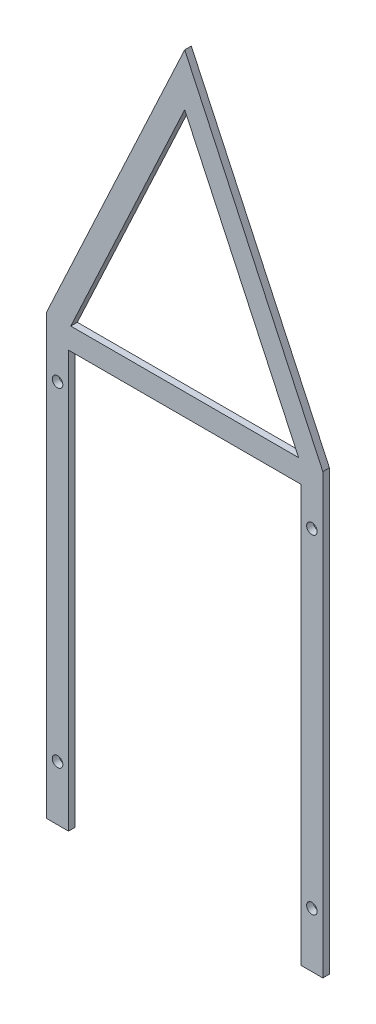
from build123d import *

# Parameters (mm, degrees)
RECTANGLE_RIB_DEPTH                  = 1.5
TRIANGLE_RIB_DEPTH                   = 3
M4_CLEARANCE_HOLE1_D                 = 4.8
MIRROR1_AT_THE_SECOND_PLANE_COPY_1_D = 4.8


with BuildPart() as part:
    # Sketch1 → Rectangle Rib (new, symmetric)
    with BuildSketch(Plane.XY):
        Polygon((-63, -100), (-53, -100), (-53, -90), (-53, 90), (53, 90), (53, -90), (53, -100), (63, -100), (63, 100), (-63, 100), align=None)
    extrude(amount=RECTANGLE_RIB_DEPTH, both=True)

    # Sketch2 → Triangle Rib (add)
    with BuildSketch(Plane.XY.offset(1.5)):
        Polygon((-63, 100), (0, 235.103935992), (63, 100), (51.96622081, 100), (0, 211.441920161), (-51.96622081, 100), align=None)
    extrude(amount=-TRIANGLE_RIB_DEPTH)

    # M4 Clearance Hole1 (through all)
    with Locations(Plane.XY.offset(1.5)):
        with Locations((-58, 75)):
            m4_clearance_hole1 = Hole(M4_CLEARANCE_HOLE1_D / 2)

    # Mirror1: M4 Clearance Hole1 across plane
    add(m4_clearance_hole1.mirror(Plane.ZX), mode=Mode.SUBTRACT)

    # Mirror1 at the second plane: M4 Clearance Hole1 across plane
    add(m4_clearance_hole1.mirror(Plane(origin=(0, 0, 0), x_dir=(0, 0, 1), z_dir=(1, 0, 0))), mode=Mode.SUBTRACT)

    # Mirror1 at the second plane copy 1 (through all)
    with Locations(Plane(origin=(0, 0, 1.5), x_dir=(-1, 0, 0), z_dir=(0, 0, 1))):
        with Locations((-58, 75)):
            Hole(MIRROR1_AT_THE_SECOND_PLANE_COPY_1_D / 2)


solid = part.part
